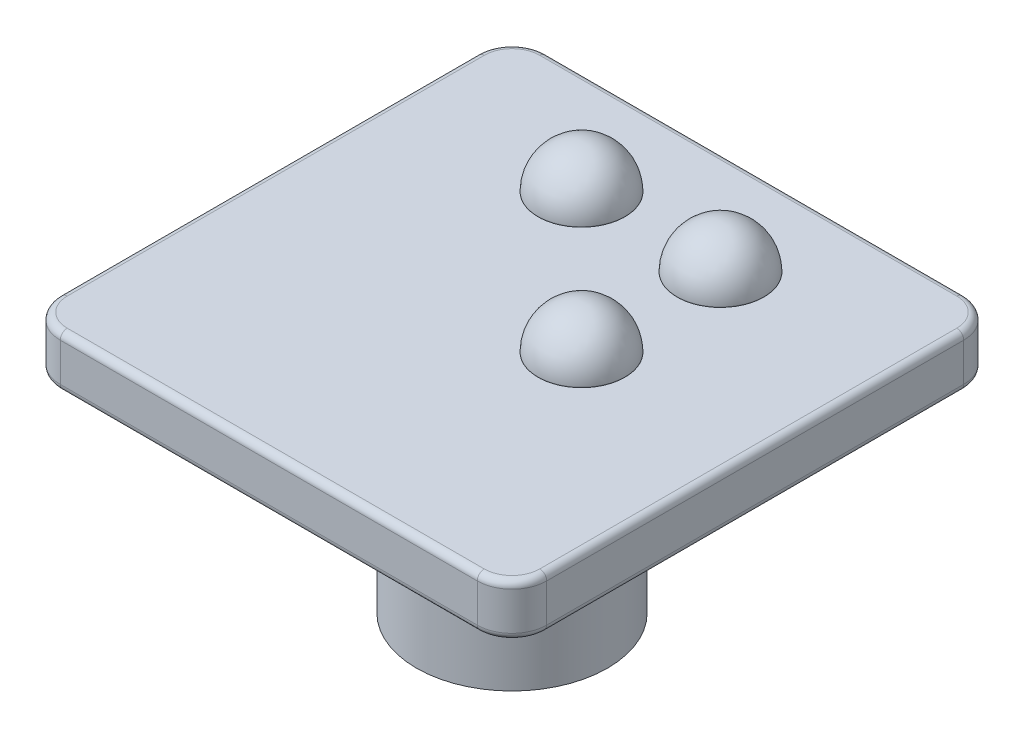
from build123d import *

# Parameters (mm, degrees)
BOSS_EXTRUDE1_DEPTH = 1.5
SKETCH2_R           = 2.75
BOSS_EXTRUDE2_DEPTH = 6
SKETCH3_W           = 1.1
SKETCH3_H           = 1.45
SKETCH3_W_2         = 1.45
SKETCH3_H_2         = 1.1
CUT_EXTRUDE1_DEPTH  = 6
CHAMFER1_SIZE       = 0.3
FILLET1_R           = 1
SKETCH4_R           = 1.25
BOSS_EXTRUDE3_DEPTH = 0.01
DOME1_FACE_RADIUS   = 1.25
DOME1_HEIGHT        = 1.25
DOME2_FACE_RADIUS   = 1.25
DOME2_HEIGHT        = 1.25
DOME4_FACE_RADIUS   = 1.25
DOME4_HEIGHT        = 1.25
FILLET3_R           = 0.2


with BuildPart() as part:
    # Sketch1 → Boss-Extrude1 (new body)
    with BuildSketch(Plane(origin=(0, 0, 0), x_dir=(1, 0, 0), z_dir=(0, 1, 0))):
        with BuildLine():
            Line((-7.324675649, 4.396717546), (4.675324351, 4.396717546))
            ThreePointArc((4.675324351, 4.396717546), (5.382431132, 4.103824327), (5.675324351, 3.396717546))
            Line((5.675324351, 3.396717546), (5.675324351, -8.603282454))
            ThreePointArc((5.675324351, -8.603282454), (5.382431132, -9.310389235), (4.675324351, -9.603282454))
            Line((4.675324351, -9.603282454), (-7.324675649, -9.603282454))
            ThreePointArc((-7.324675649, -9.603282454), (-8.03178243, -9.310389235), (-8.324675649, -8.603282454))
            Line((-8.324675649, -8.603282454), (-8.324675649, 3.396717546))
            ThreePointArc((-8.324675649, 3.396717546), (-8.03178243, 4.103824327), (-7.324675649, 4.396717546))
        make_face()
    extrude(amount=BOSS_EXTRUDE1_DEPTH)

    # Sketch2 → Boss-Extrude2 (add)
    with BuildSketch(Plane.XZ):
        with Locations(Location((-1.324675649, 2.603282454, 0), (0, 0, 270))):
            Circle(SKETCH2_R)
    extrude(amount=BOSS_EXTRUDE2_DEPTH)

    # Sketch3 → Cut-Extrude1 (cut)
    with BuildSketch(Plane.XZ.offset(6)):
        with Locations((-1.324675649, 3.878282454)):
            Rectangle(SKETCH3_W, SKETCH3_H)
        with Locations((-0.049675649, 2.603282454)):
            Rectangle(SKETCH3_W_2, SKETCH3_H_2)
        with Locations((-1.324675649, 2.603282454)):
            Rectangle(SKETCH3_W, SKETCH3_H_2)
        with Locations((-2.599675649, 2.603282454)):
            Rectangle(SKETCH3_W_2, SKETCH3_H_2)
        with Locations((-1.324675649, 1.328282454)):
            Rectangle(SKETCH3_W, SKETCH3_H)
    extrude(amount=-CUT_EXTRUDE1_DEPTH, mode=Mode.SUBTRACT)

    # Chamfer1
    chamfer1_edges = [part.edges().sort_by_distance(p)[0] for p in [
        (-0.774675649, -6, 3.878282454),
        (-0.049675649, -6, 3.153282454),
        (0.675324351, -6, 2.603282454),
        (-0.774675649, -6, 1.328282454),
        (-2.599675649, -6, 3.153282454),
        (-1.324675649, -6, 4.603282454),
        (-1.874675649, -6, 3.878282454),
        (-3.324675649, -6, 2.603282454),
        (-2.599675649, -6, 2.053282454),
        (-1.874675649, -6, 1.328282454),
        (-1.324675649, -6, 0.603282454),
        (-0.049675649, -6, 2.053282454),
    ]]
    chamfer(chamfer1_edges, length=CHAMFER1_SIZE)

    # Fillet1
    fillet1_edges = [part.edges().sort_by_distance(p)[0] for p in [
        (-1.324675649, 0, 5.353282454),
    ]]
    fillet(fillet1_edges, radius=FILLET1_R)

    # Sketch4 → Boss-Extrude3 (add)
    with BuildSketch(Plane(origin=(0, 1.5, 0), x_dir=(1, 0, 0), z_dir=(0, 1, 0))):
        with Locations(Location((-3.324675649, 1.396717546, 0), (0, 0, 90))):
            Circle(SKETCH4_R)
        with Locations(Location((0.675324351, -2.603282454, 0), (0, 0, 90))):
            Circle(SKETCH4_R)
        with Locations(Location((0.675324351, 1.396717546, 0), (0, 0, 90))):
            Circle(SKETCH4_R)
    extrude(amount=BOSS_EXTRUDE3_DEPTH)

    # Dome1: a dome of height H over a round flat face of radius A is a cap of a sphere of radius (A * A + H * H) / (2 * H)
    dome1_r = (DOME1_FACE_RADIUS * DOME1_FACE_RADIUS + DOME1_HEIGHT * DOME1_HEIGHT) / (2 * DOME1_HEIGHT)
    dome1_base = Plane((-3.324675649, 1.51, -1.396717546), z_dir=(0, 1, 0))
    with Locations(dome1_base.offset(DOME1_HEIGHT - dome1_r)):
        dome1_ball = Sphere(dome1_r, mode=Mode.PRIVATE)
    add(split(dome1_ball, bisect_by=dome1_base, keep=Keep.TOP, mode=Mode.PRIVATE))

    # Dome2: a dome of height H over a round flat face of radius A is a cap of a sphere of radius (A * A + H * H) / (2 * H)
    dome2_r = (DOME2_FACE_RADIUS * DOME2_FACE_RADIUS + DOME2_HEIGHT * DOME2_HEIGHT) / (2 * DOME2_HEIGHT)
    dome2_base = Plane((0.675324351, 1.51, -1.396717546), z_dir=(0, 1, 0))
    with Locations(dome2_base.offset(DOME2_HEIGHT - dome2_r)):
        dome2_ball = Sphere(dome2_r, mode=Mode.PRIVATE)
    add(split(dome2_ball, bisect_by=dome2_base, keep=Keep.TOP, mode=Mode.PRIVATE))

    # Dome4: a dome of height H over a round flat face of radius A is a cap of a sphere of radius (A * A + H * H) / (2 * H)
    dome4_r = (DOME4_FACE_RADIUS * DOME4_FACE_RADIUS + DOME4_HEIGHT * DOME4_HEIGHT) / (2 * DOME4_HEIGHT)
    dome4_base = Plane((0.675324351, 1.51, 2.603282454), z_dir=(0, 1, 0))
    with Locations(dome4_base.offset(DOME4_HEIGHT - dome4_r)):
        dome4_ball = Sphere(dome4_r, mode=Mode.PRIVATE)
    add(split(dome4_ball, bisect_by=dome4_base, keep=Keep.TOP, mode=Mode.PRIVATE))

    # Fillet3
    fillet3_edges = [part.edges().sort_by_distance(p)[0] for p in [
        (5.382431132, 1.5, 9.310389235),
        (-1.324675649, 0, 9.603282454),
        (-8.03178243, 0, 9.310389235),
        (5.675324351, 1.5, 2.603282454),
        (5.382431132, 1.5, -4.103824327),
        (-1.324675649, 1.5, -4.396717546),
        (-8.03178243, 1.5, -4.103824327),
        (-8.324675649, 1.5, 2.603282454),
        (-8.03178243, 1.5, 9.310389235),
        (-1.324675649, 1.5, 9.603282454),
        (-8.324675649, 0, 2.603282454),
        (-8.03178243, 0, -4.103824327),
        (-1.324675649, 0, -4.396717546),
        (5.382431132, 0, -4.103824327),
        (5.675324351, 0, 2.603282454),
        (5.382431132, 0, 9.310389235),
    ]]
    fillet(fillet3_edges, radius=FILLET3_R)


solid = part.part
